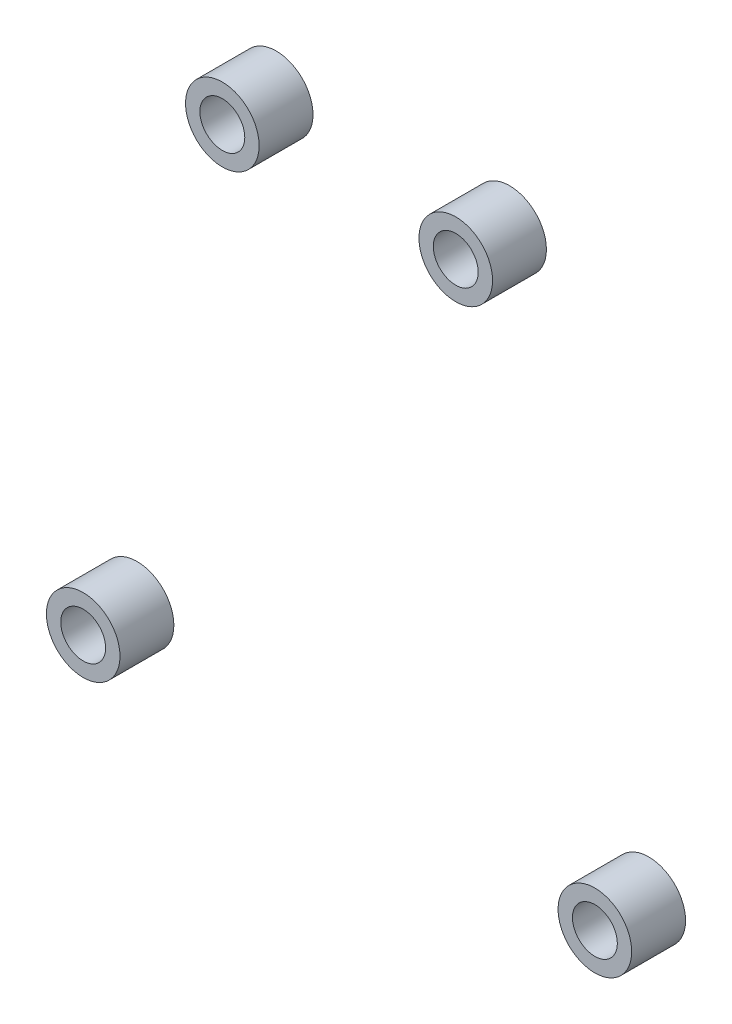
from build123d import *

# Parameters (mm, degrees)
SKETCH_1_R        = 2.05
SKETCH_1_R_2      = 1.25
EXTRUDE_1_DEPTH   = 3
EXTRUDE_1_2_DEPTH = 3
EXTRUDE_1_3_DEPTH = 3
EXTRUDE_1_4_DEPTH = 3


with BuildPart() as part:
    # Эскиз1 → Бобышка-Вытянуть1 (new body)
    with BuildSketch(Plane.XY):
        with Locations((6.5, 14.25)):
            Circle(SKETCH_1_R)
        with Locations((6.5, 14.25)):
            Circle(SKETCH_1_R_2, mode=Mode.SUBTRACT)
    extrude(amount=EXTRUDE_1_DEPTH)


with BuildPart() as body_2:
    # Эскиз1 → Extrude 1 2 (new body)
    with BuildSketch(Plane.XY):
        with Locations((14.25, -14.25)):
            Circle(SKETCH_1_R)
        with Locations((14.25, -14.25)):
            Circle(SKETCH_1_R_2, mode=Mode.SUBTRACT)
    extrude(amount=EXTRUDE_1_2_DEPTH)


with BuildPart() as body_3:
    # Эскиз1 → Extrude 1 3 (new body)
    with BuildSketch(Plane.XY):
        with Locations((-14.25, -14.25)):
            Circle(SKETCH_1_R)
        with Locations((-14.25, -14.25)):
            Circle(SKETCH_1_R_2, mode=Mode.SUBTRACT)
    extrude(amount=EXTRUDE_1_3_DEPTH)


with BuildPart() as body_4:
    # Эскиз1 → Extrude 1 4 (new body)
    with BuildSketch(Plane.XY):
        with Locations((-6.5, 14.25)):
            Circle(SKETCH_1_R)
        with Locations((-6.5, 14.25)):
            Circle(SKETCH_1_R_2, mode=Mode.SUBTRACT)
    extrude(amount=EXTRUDE_1_4_DEPTH)


solid = Compound([part.part, body_2.part, body_3.part, body_4.part])
